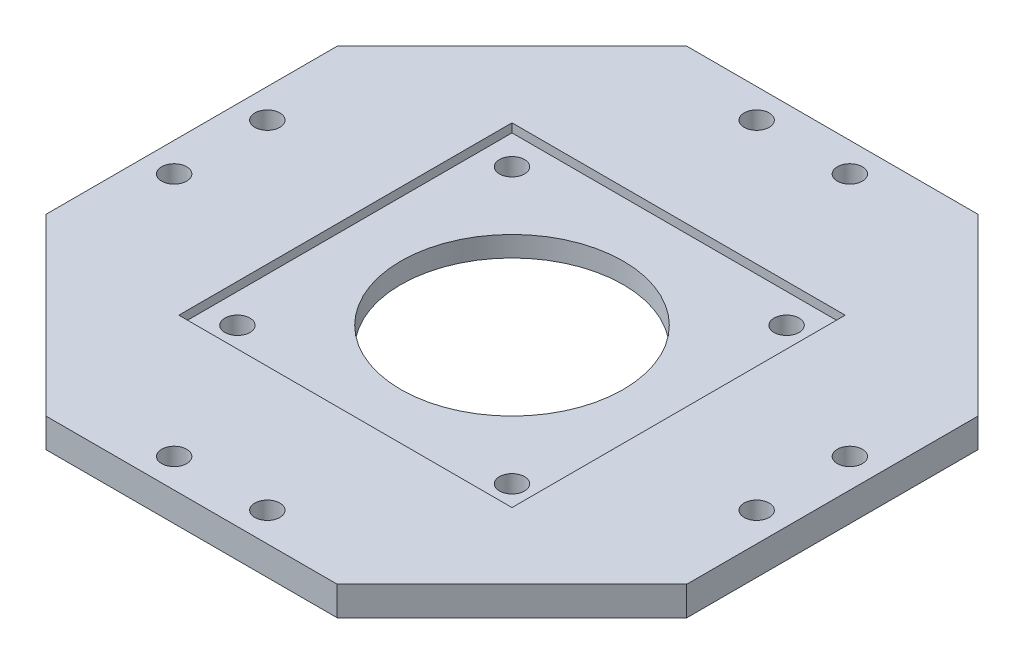
from build123d import *

# Parameters (mm, degrees)
SKETCH1_R           = 2.15
SKETCH1_R_2         = 19.1
BOSS_EXTRUDE1_DEPTH = 5
SKETCH2_W           = 57.2
SKETCH2_H           = 57.2
CUT_EXTRUDE1_DEPTH  = 1.5


with BuildPart() as part:
    # Sketch1 → Boss-Extrude1 (new body)
    with BuildSketch(Plane(origin=(0, 0, 0), x_dir=(1, 0, 0), z_dir=(0, 1, 0))):
        Polygon((-25, -55), (25, -55), (55, -25), (55, 25), (25, 55), (-25, 55), (-55, 25), (-55, -25), align=None)
        with Locations(Location((23.57, 23.57, 0), (0, 0, 270))):
            Circle(SKETCH1_R, mode=Mode.SUBTRACT)
        with Locations(Location((-23.57, 23.57, 0), (0, 0, 270))):
            Circle(SKETCH1_R, mode=Mode.SUBTRACT)
        with Locations(Location((-23.57, -23.57, 0), (0, 0, 270))):
            Circle(SKETCH1_R, mode=Mode.SUBTRACT)
        with Locations(Location((23.57, -23.57, 0), (0, 0, 270))):
            Circle(SKETCH1_R, mode=Mode.SUBTRACT)
        with Locations(Location((0, 0, 0), (0, 0, 270))):
            Circle(SKETCH1_R_2, mode=Mode.SUBTRACT)
        with Locations(Location((-8, 50, 0), (0, 0, 270))):
            Circle(SKETCH1_R, mode=Mode.SUBTRACT)
        with Locations(Location((8, 50, 0), (0, 0, 90))):
            Circle(SKETCH1_R, mode=Mode.SUBTRACT)
        with Locations(Location((50, 8, 0), (0, 0, 270))):
            Circle(SKETCH1_R, mode=Mode.SUBTRACT)
        with Locations(Location((50, -8, 0), (0, 0, 90))):
            Circle(SKETCH1_R, mode=Mode.SUBTRACT)
        with Locations(Location((8, -50, 0), (0, 0, 270))):
            Circle(SKETCH1_R, mode=Mode.SUBTRACT)
        with Locations(Location((-8, -50, 0), (0, 0, 90))):
            Circle(SKETCH1_R, mode=Mode.SUBTRACT)
        with Locations(Location((-50, -8, 0), (0, 0, 270))):
            Circle(SKETCH1_R, mode=Mode.SUBTRACT)
        with Locations(Location((-50, 8, 0), (0, 0, 90))):
            Circle(SKETCH1_R, mode=Mode.SUBTRACT)
    extrude(amount=BOSS_EXTRUDE1_DEPTH)

    # Sketch2 → Cut-Extrude1 (cut)
    with BuildSketch(Plane(origin=(0, 5, 0), x_dir=(1, 0, 0), z_dir=(0, 1, 0))):
        Rectangle(SKETCH2_W, SKETCH2_H)
    extrude(amount=-CUT_EXTRUDE1_DEPTH, mode=Mode.SUBTRACT)


solid = part.part
